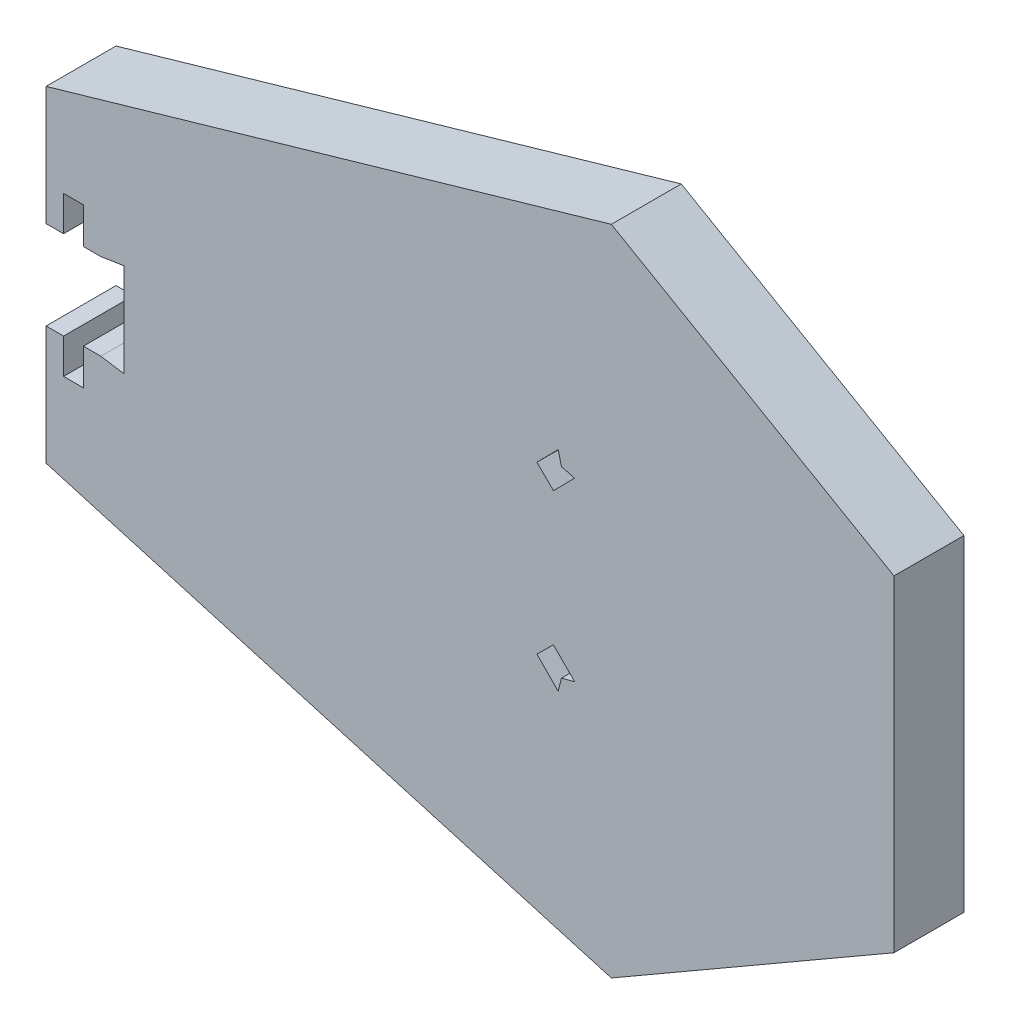
from build123d import *

# Parameters (mm, degrees)
BOSS_EXTRUDE1_DEPTH = 6
CUT_EXTRUDE1_DEPTH  = 51.439717383


with BuildPart() as part:
    # Sketch1 → Boss-Extrude1 (new body)
    # profile 1 of 2: a face of its own
    with BuildSketch(Plane.XY):
        Polygon((31.223066959, -14), (31.223066959, 0), (-34.823066959, 0), (-34.823066959, -4.01574156), (-36.823066959, -3.7), (-41.523066959, -3.7), (-41.523066959, -14), (6.974355653, -28), align=None)
        Polygon((2.700425446, -7.850425446), (2.408714576, -8.979109263), (0.584447895, -7.127556852), (2.009048725, -5.723949904), (3.819278422, -7.561255379), align=None, mode=Mode.SUBTRACT)
    # profile 2 of 2: a face of its own
    with BuildSketch(Plane.XY):
        Polygon((31.223066959, 0), (31.223066959, 14), (6.974355653, 28), (-41.523066959, 14), (-41.523066959, 3.7), (-36.823066959, 3.7), (-34.823066959, 4.01574156), (-34.823066959, 0), align=None)
        Polygon((2.408714576, 8.979109263), (2.700425446, 7.850425446), (3.819278422, 7.561255379), (2.009048725, 5.723949904), (0.584447895, 7.127556852), align=None, mode=Mode.SUBTRACT)
    extrude(amount=BOSS_EXTRUDE1_DEPTH)

    # Sketch2 → Cut-Extrude1 (cut, through all)
    with BuildSketch(Plane.XY.offset(6)):
        Polygon((-41.623066959, -3.427539205), (-41.623066959, -3.8), (-40.023066959, -3.8), (-40.023066959, -6.8), (-38.323066959, -6.8), (-38.323066959, 6.8), (-40.023066959, 6.8), (-40.023066959, 3.8), (-41.623066959, 3.8), (-41.623066959, 3.427539205), align=None)
    extrude(amount=-CUT_EXTRUDE1_DEPTH, mode=Mode.SUBTRACT)


solid = part.part
